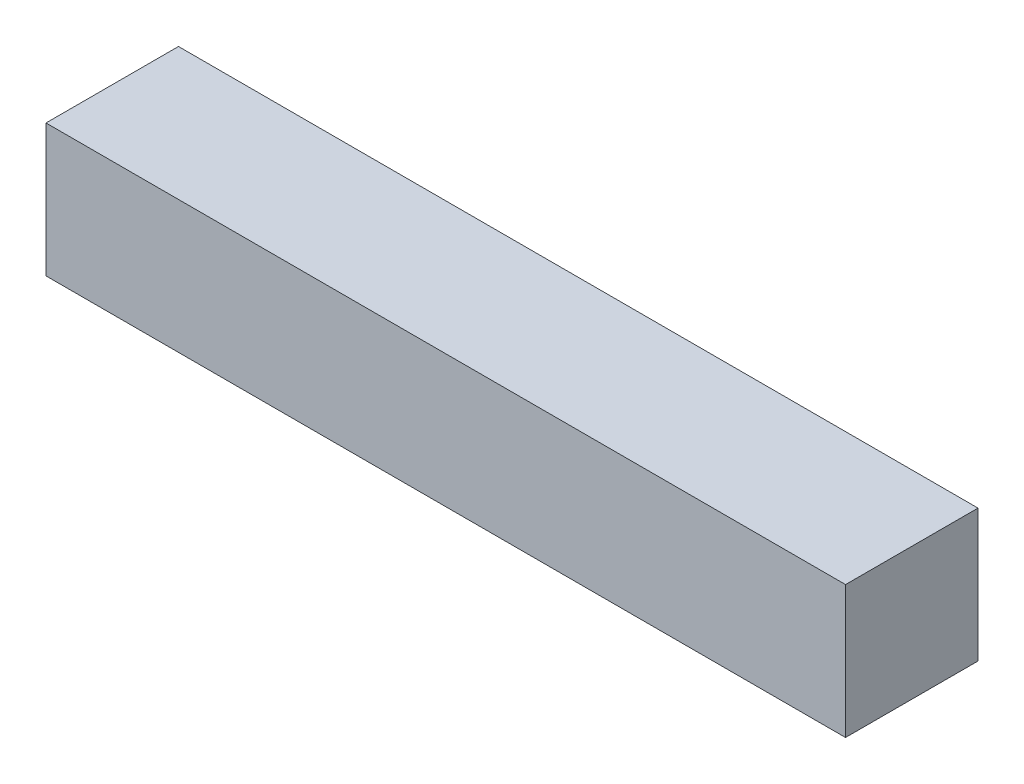
from build123d import *

# Parameters (mm, degrees)
SKETCH1_W           = 28
SKETCH1_H           = 28
BOSS_EXTRUDE1_DEPTH = 169


with BuildPart() as part:
    # Sketch1 → Boss-Extrude1 (new body)
    with BuildSketch(Plane(origin=(0, 0, 0), x_dir=(0, 0, -1), z_dir=(1, 0, 0))):
        Rectangle(SKETCH1_W, SKETCH1_H)
    extrude(amount=BOSS_EXTRUDE1_DEPTH)


solid = part.part
